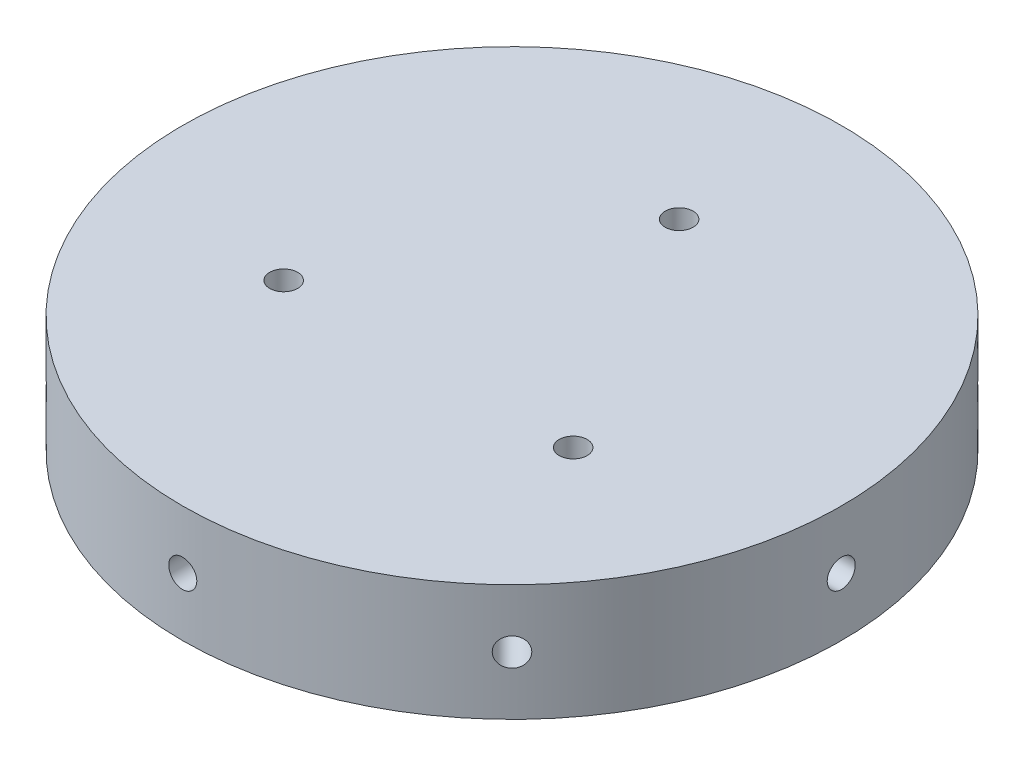
from build123d import *

# Parameters (mm, degrees)
SKETCH_1_R               = 28.5
EXTRUDE_1_DEPTH          = 10
SKETCH_36_R              = 3.85
EXTRUDE_5_DEPTH          = 5
PATTERN_CIRCULAR_4_COUNT = 8
SKETCH_42_R              = 39.215237935
SKETCH_42_R_2            = 28.25
CUT_EXTRUDE_1_DEPTH      = 44.005813698
HOLE_WIZARD_M2_3_D       = 2.4


with BuildPart() as part:
    # 스케치1 → 보스-돌출1 (new body)
    with BuildSketch(Plane(origin=(0, 0, 0), x_dir=(1, 0, 0), z_dir=(0, 1, 0))):
        with Locations(Location((0, 0, 0), (0, 0, 270))):
            Circle(SKETCH_1_R)
    extrude(amount=EXTRUDE_1_DEPTH)

    # 스케치36 → 보스-돌출5 (add)
    with BuildSketch(Plane.XZ):
        with Locations(Location((0, 14.33, 0), (0, 0, 90))):
            Circle(SKETCH_36_R)
        with Locations(Location((12.410144036, -7.165, 0), (0, 0, 90))):
            Circle(SKETCH_36_R)
        with Locations(Location((-12.410144036, -7.165, 0), (0, 0, 90))):
            Circle(SKETCH_36_R)
    extrude(amount=EXTRUDE_5_DEPTH)

    # 스케치41 → M2 여유 구멍1 (revolve, cut)
    with BuildSketch(Plane(origin=(-28.5, 5, 0), x_dir=(0, 0, 1), z_dir=(0, 1, 0))):
        Polygon((0, 0), (0, 15.721032743), (1.2, 15), (1.2, 0), align=None)
    hole_wizard_m2_1 = revolve(axis=Axis((-34.85, 5, 0), (1, 0, 0)), mode=Mode.SUBTRACT)

    # 원형 패턴4: M2 여유 구멍1 ×8 about axis
    pattern_circular_4_axis = Axis((0, 10, 0), (0, 1, 0))
    for i in range(1, PATTERN_CIRCULAR_4_COUNT):
        add(hole_wizard_m2_1.rotate(pattern_circular_4_axis, i * 360 / PATTERN_CIRCULAR_4_COUNT), mode=Mode.SUBTRACT)

    # 스케치42 → 컷-돌출1 (cut, through all)
    with BuildSketch(Plane(origin=(0, 10, 0), x_dir=(1, 0, 0), z_dir=(0, 1, 0))):
        Circle(SKETCH_42_R)
        with Locations(Location((0, 0, 0), (0, 0, 270))):
            Circle(SKETCH_42_R_2, mode=Mode.SUBTRACT)
    extrude(amount=-CUT_EXTRUDE_1_DEPTH, mode=Mode.SUBTRACT)

    # M2 여유 구멍3 (through all)
    with Locations(Plane(origin=(0, 0, 0), x_dir=(-1, 0, 0), z_dir=(0, -1, 0))):
        with Locations((-12.410144036, -7.165), (0, 14.33), (12.410144036, -7.165)):
            Hole(HOLE_WIZARD_M2_3_D / 2)


solid = part.part
